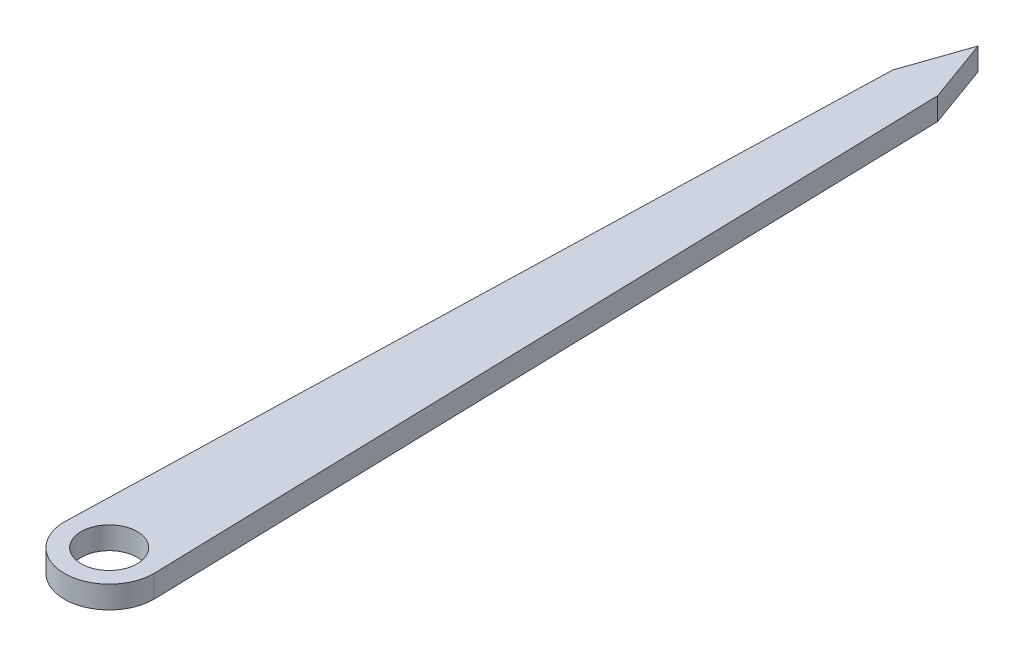
from build123d import *

# Parameters (mm, degrees)
SKICA1_R                 = 2
P_IDAT_VYSUNUT_M3_DEPTH  = 2
ODEBRAT_START            = -18
SKICA5_R                 = 2.5
SKICA5_R_2               = 2
ODEBRAT_VYSUNUT_M1_DEPTH = 18


with BuildPart() as part:
    # Skica1 → Přidat vysunutím3 (new body)
    # profile 1 of 2: a face of its own
    with BuildSketch(Plane(origin=(0, 0, 0), x_dir=(1, 0, 0), z_dir=(0, 1, 0))):
        with BuildLine():
            Line((108.040914438, 105.971068272), (106.006427981, 34.226677149))
            ThreePointArc((106.006427981, 34.226677149), (110.004588085, 37.999997369), (113.994081517, 34.217515135))
            Line((113.994081517, 34.217515135), (112.040914438, 106))
            Line((112.040914438, 106), (110, 111.642221926))
            Line((110, 111.642221926), (108.040914438, 105.971068272))
        make_face()
    # profile 2 of 2: a face of its own
    with BuildSketch(Plane(origin=(0, 0, 0), x_dir=(1, 0, 0), z_dir=(0, 1, 0))):
        with BuildLine():
            ThreePointArc((106, 34), (107.171572875, 31.171572875), (110, 30))
            ThreePointArc((110, 30), (112.828427125, 31.171572875), (114, 34))
            Line((114, 34), (113.994081517, 34.217515135))
            ThreePointArc((113.994081517, 34.217515135), (110.004588085, 37.999997369), (106.006427981, 34.226677149))
            Line((106.006427981, 34.226677149), (106, 34))
        make_face()
        with Locations(Location((110, 34, 0), (0, 0, 270))):
            Circle(SKICA1_R, mode=Mode.SUBTRACT)
    extrude(amount=P_IDAT_VYSUNUT_M3_DEPTH)

    # Skica5 → Odebrat vysunutím1 (cut)
    with BuildSketch(Plane(origin=(0, 2, 0), x_dir=(1, 0, 0), z_dir=(0, 1, 0)).offset(ODEBRAT_START)):
        with Locations(Location((110, 34, 0), (0, 0, 270))):
            Circle(SKICA5_R)
        with Locations((110, 34)):
            Circle(SKICA5_R_2, mode=Mode.SUBTRACT)
    extrude(amount=ODEBRAT_VYSUNUT_M1_DEPTH, mode=Mode.SUBTRACT)


solid = part.part
